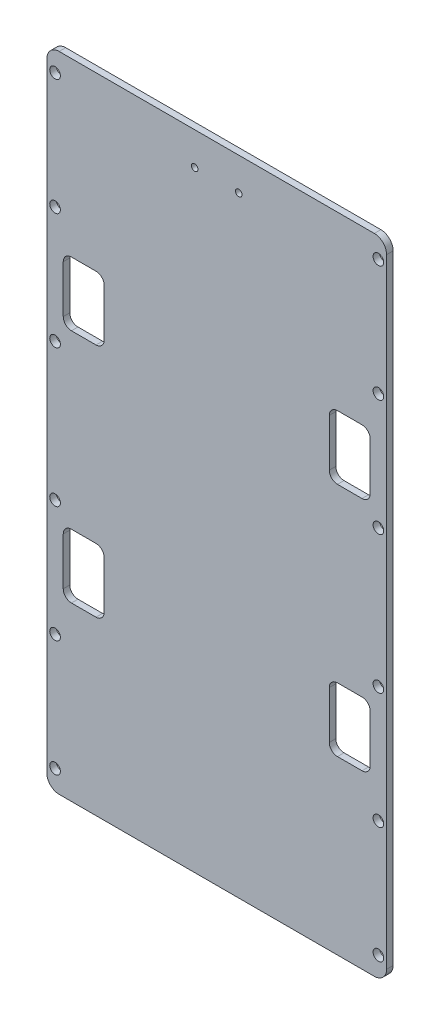
from build123d import *

# Parameters (mm, degrees)
GENERAL_SHAPE_DEPTH        = 1.6
M2_CLEARANCE_HOLE1_D       = 2.6
MIRROR2_COPY_1_D           = 2.6
SKETCH5_R                  = 0.8
CONNECTOR_HOLES_DEPTH      = 89.897525275
STAR_TRACKER_CUTOUTS_DEPTH = 89.897525275


with BuildPart() as part:
    # Sketch1 → General Shape (new body)
    with BuildSketch(Plane.XY):
        with BuildLine():
            Line((-38.5, 78.6), (38.5, 78.6))
            ThreePointArc((38.5, 78.6), (40.621320344, 77.721320344), (41.5, 75.6))
            Line((41.5, 75.6), (41.5, -75.6))
            ThreePointArc((41.5, -75.6), (40.621320344, -77.721320344), (38.5, -78.6))
            Line((38.5, -78.6), (-38.5, -78.6))
            ThreePointArc((-38.5, -78.6), (-40.621320344, -77.721320344), (-41.5, -75.6))
            Line((-41.5, -75.6), (-41.5, 75.6))
            ThreePointArc((-41.5, 75.6), (-40.621320344, 77.721320344), (-38.5, 78.6))
        make_face()
    extrude(amount=GENERAL_SHAPE_DEPTH)

    # M2 Clearance Hole1 (through all)
    with Locations(Plane(origin=(-39.5, 73.6, 0), x_dir=(-1, 0, 0), z_dir=(0, 0, -1))):
        with Locations((0, 0), (0, -28.4), (0, -56.8)):
            m2_clearance_hole1 = Hole(M2_CLEARANCE_HOLE1_D / 2)

    # Mirror1: M2 Clearance Hole1 across plane
    add(m2_clearance_hole1.mirror(Plane(origin=(0, 0, 0), x_dir=(0, 0, 1), z_dir=(1, 0, 0))), mode=Mode.SUBTRACT)

    # Mirror2: M2 Clearance Hole1 across plane
    add(m2_clearance_hole1.mirror(Plane.ZX), mode=Mode.SUBTRACT)

    # Mirror2 copy 1 (through all)
    with Locations(Plane(origin=(39.5, -73.6, 0), x_dir=(1, 0, 0), z_dir=(0, 0, -1))):
        with Locations((0, 0), (0, -28.4), (0, -56.8)):
            Hole(MIRROR2_COPY_1_D / 2)

    # Sketch5 → Connector holes (cut, through all)
    with BuildSketch(Plane(origin=(0, 0, 0), x_dir=(-1, 0, 0), z_dir=(0, 0, -1))):
        with Locations((-5.38, 70.6)):
            Circle(SKETCH5_R)
        with Locations((5.38, 70.6)):
            Circle(SKETCH5_R)
    extrude(amount=-CONNECTOR_HOLES_DEPTH, mode=Mode.SUBTRACT)

    # Sketch6 → Star Tracker Cutouts (cut, through all)
    with BuildSketch(Plane(origin=(0, 0, 0), x_dir=(-1, 0, 0), z_dir=(0, 0, -1))):
        with BuildLine():
            Line((-35.5, 36.6), (-29.5, 36.6))
            ThreePointArc((-29.5, 36.6), (-28.085786438, 36.014213562), (-27.5, 34.6))
            Line((-27.5, 34.6), (-27.5, 23))
            ThreePointArc((-27.5, 23), (-28.085786438, 21.585786438), (-29.5, 21))
            Line((-29.5, 21), (-35.5, 21))
            ThreePointArc((-35.5, 21), (-36.914213562, 21.585786438), (-37.5, 23))
            Line((-37.5, 23), (-37.5, 34.6))
            ThreePointArc((-37.5, 34.6), (-36.914213562, 36.014213562), (-35.5, 36.6))
        make_face()
        with BuildLine():
            Line((29.5, 36.6), (35.5, 36.6))
            ThreePointArc((35.5, 36.6), (36.914213562, 36.014213562), (37.5, 34.6))
            Line((37.5, 34.6), (37.5, 23))
            ThreePointArc((37.5, 23), (36.914213562, 21.585786438), (35.5, 21))
            Line((35.5, 21), (29.5, 21))
            ThreePointArc((29.5, 21), (28.085786438, 21.585786438), (27.5, 23))
            Line((27.5, 23), (27.5, 34.6))
            ThreePointArc((27.5, 34.6), (28.085786438, 36.014213562), (29.5, 36.6))
        make_face()
        with BuildLine():
            Line((-35.5, -21), (-29.5, -21))
            ThreePointArc((-29.5, -21), (-28.085786438, -21.585786438), (-27.5, -23))
            Line((-27.5, -23), (-27.5, -34.6))
            ThreePointArc((-27.5, -34.6), (-28.085786438, -36.014213562), (-29.5, -36.6))
            Line((-29.5, -36.6), (-35.5, -36.6))
            ThreePointArc((-35.5, -36.6), (-36.914213562, -36.014213562), (-37.5, -34.6))
            Line((-37.5, -34.6), (-37.5, -23))
            ThreePointArc((-37.5, -23), (-36.914213562, -21.585786438), (-35.5, -21))
        make_face()
        with BuildLine():
            Line((29.5, -21), (35.5, -21))
            ThreePointArc((35.5, -21), (36.914213562, -21.585786438), (37.5, -23))
            Line((37.5, -23), (37.5, -34.6))
            ThreePointArc((37.5, -34.6), (36.914213562, -36.014213562), (35.5, -36.6))
            Line((35.5, -36.6), (29.5, -36.6))
            ThreePointArc((29.5, -36.6), (28.085786438, -36.014213562), (27.5, -34.6))
            Line((27.5, -34.6), (27.5, -23))
            ThreePointArc((27.5, -23), (28.085786438, -21.585786438), (29.5, -21))
        make_face()
    extrude(amount=-STAR_TRACKER_CUTOUTS_DEPTH, mode=Mode.SUBTRACT)


solid = part.part
